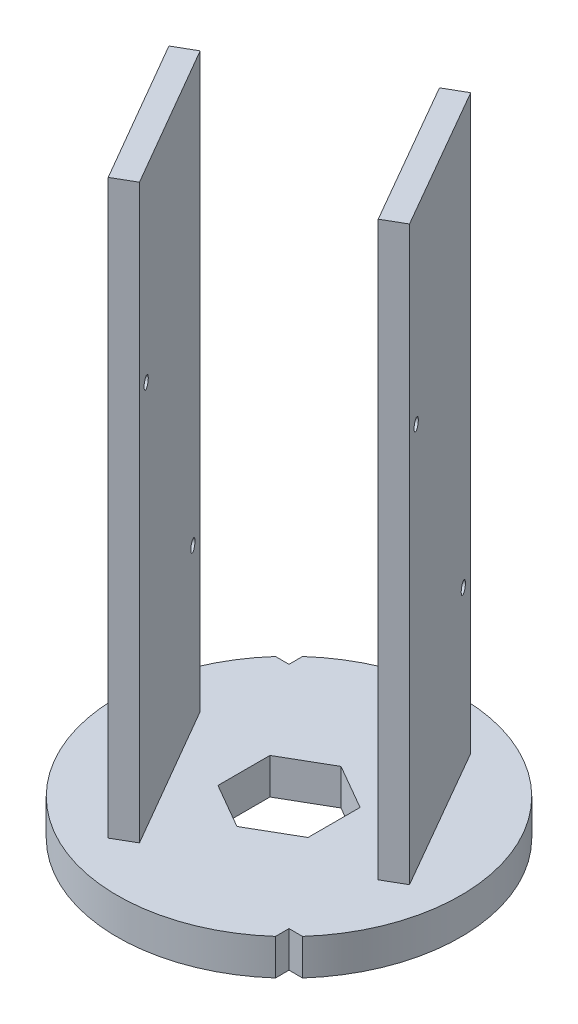
from build123d import *

# Parameters (mm, degrees)
BOSS_EXTRUDE1_DEPTH = 8
BOSS_EXTRUDE3_DEPTH = 127
SKETCH8_R           = 1.27
CUT_EXTRUDE1_DEPTH  = 127


with BuildPart() as part:
    # Sketch2 → Boss-Extrude1 (new body)
    with BuildSketch(Plane(origin=(0, 0, 0), x_dir=(1, 0, 0), z_dir=(0, 1, 0))):
        with BuildLine():
            ThreePointArc((-28.398063314, 25.4), (-26.940768363, -26.940768363), (25.4, -28.398063314))
            Line((25.4, -28.398063314), (25.4, -25.4))
            Line((25.4, -25.4), (28.398063314, -25.4))
            ThreePointArc((28.398063314, -25.4), (26.940768363, 26.940768363), (-25.4, 28.398063314))
            Line((-25.4, 28.398063314), (-25.4, 25.4))
            Line((-25.4, 25.4), (-28.398063314, 25.4))
        make_face()
        Polygon((10, 5.773502692), (10, -5.773502692), (0, -11.547005384), (-10, -5.773502692), (-10, 5.773502692), (0, 11.547005384), align=None, mode=Mode.SUBTRACT)
    extrude(amount=BOSS_EXTRUDE1_DEPTH)

    # Sketch7 → Boss-Extrude3 (add)
    with BuildSketch(Plane(origin=(0, 8, 0), x_dir=(1, 0, 0), z_dir=(0, 1, 0))):
        Polygon((-30.57279496, 3.913767238), (-12.055750961, -28.074116851), (-7.659250908, -25.529084967), (-26.176294907, 6.458799122), align=None)
    boss_extrude3 = extrude(amount=BOSS_EXTRUDE3_DEPTH)

    # Mirror1: Boss-Extrude3 across plane
    add(boss_extrude3.mirror(Plane(origin=(-21.745710428, -1.979026449, -37.664675308), x_dir=(0.4999999999999996, 0, 0.8660254037844389), z_dir=(0.8660254037844389, 0, -0.4999999999999996))))

    # Sketch8 → Cut-Extrude1 (cut)
    with BuildSketch(Plane(origin=(21.230367371, 0, -12.224992283), x_dir=(-0.49900881712180367, 0, -0.8665969076997092), z_dir=(0.8665969076997092, 0, -0.49900881712180367))):
        with Locations((-14.202194794, 93.725)):
            Circle(SKETCH8_R)
        with Locations((14.245786586, 42.925)):
            Circle(SKETCH8_R)
    extrude(amount=-CUT_EXTRUDE1_DEPTH, mode=Mode.SUBTRACT)


solid = part.part
